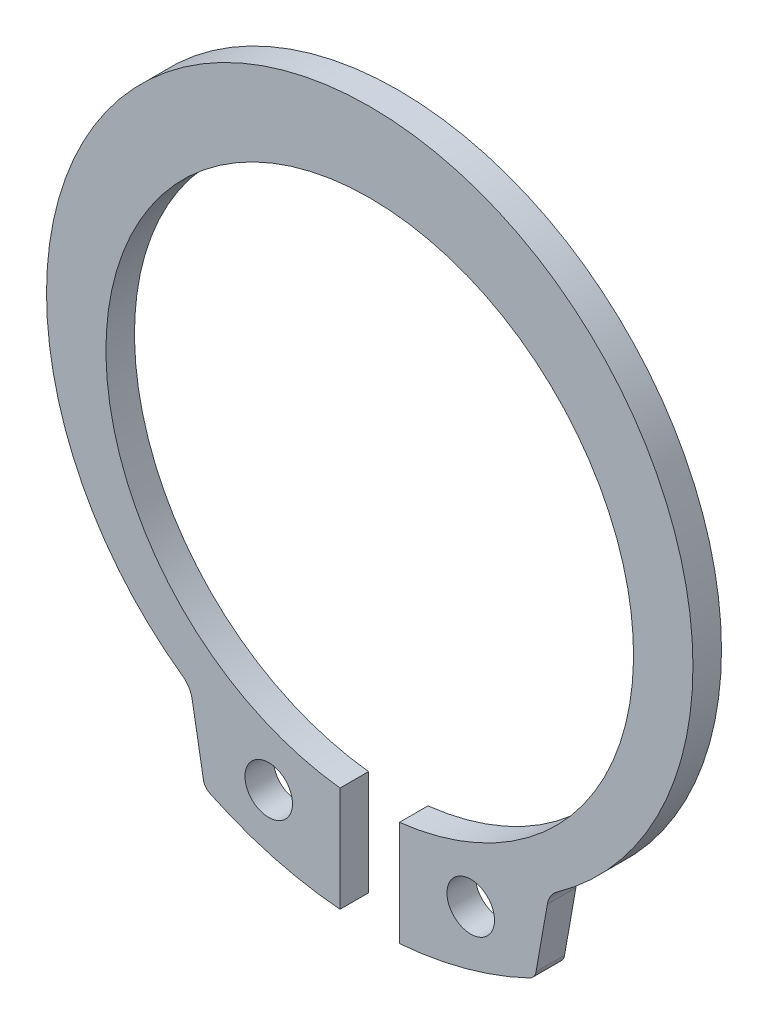
from build123d import *

# Parameters (mm, degrees)
SKETCH1_R     = 1
BODY_DEPTH    = 1.2
FILLET1_R     = 0.5
FILLET2_R     = 1
SCALE_1_SCALE = 0.25


with BuildPart() as part:
    # Sketch1 → Body (new body)
    with BuildSketch(Plane.XY):
        with BuildLine():
            Line((-1.25, -11.859392549), (-1.25, -16.279514555))
            ThreePointArc((-1.25, -16.279514555), (-4.178435105, -15.756174328), (-6.952957407, -14.683027947))
            Line((-6.952957407, -14.683027947), (-7.547042593, -11.313803432))
            ThreePointArc((-7.547042593, -11.313803432), (0, 13.6), (7.547042593, -11.313803432))
            Line((7.547042593, -11.313803432), (6.952957407, -14.683027947))
            ThreePointArc((6.952957407, -14.683027947), (4.178435105, -15.756174328), (1.25, -16.279514555))
            Line((1.25, -16.279514555), (1.25, -11.859392549))
            ThreePointArc((1.25, -11.859392549), (0, 10.27), (-1.25, -11.859392549))
        make_face()
        with Locations(Location((4.25, -13.432678287, 0), (0, 0, 180))):
            Circle(SKETCH1_R, mode=Mode.SUBTRACT)
        with Locations((-4.25, -13.432678287)):
            Circle(SKETCH1_R, mode=Mode.SUBTRACT)
    extrude(amount=-BODY_DEPTH)

    # Fillet1
    fillet1_edges = [part.edges().sort_by_distance(p)[0] for p in [
        (-6.952957407, -14.683027947, -0.6),
        (6.952957407, -14.683027947, -0.6),
    ]]
    fillet(fillet1_edges, radius=FILLET1_R)

    # Fillet2
    fillet2_edges = [part.edges().sort_by_distance(p)[0] for p in [
        (-7.547042593, -11.313803432, -0.6),
        (7.547042593, -11.313803432, -0.6),
    ]]
    fillet(fillet2_edges, radius=FILLET2_R)


with BuildPart() as part_1:
    # 缩放比例1: scaled about (0, 0, 0)
    add(part.part.scale(SCALE_1_SCALE))


solid = part_1.part
